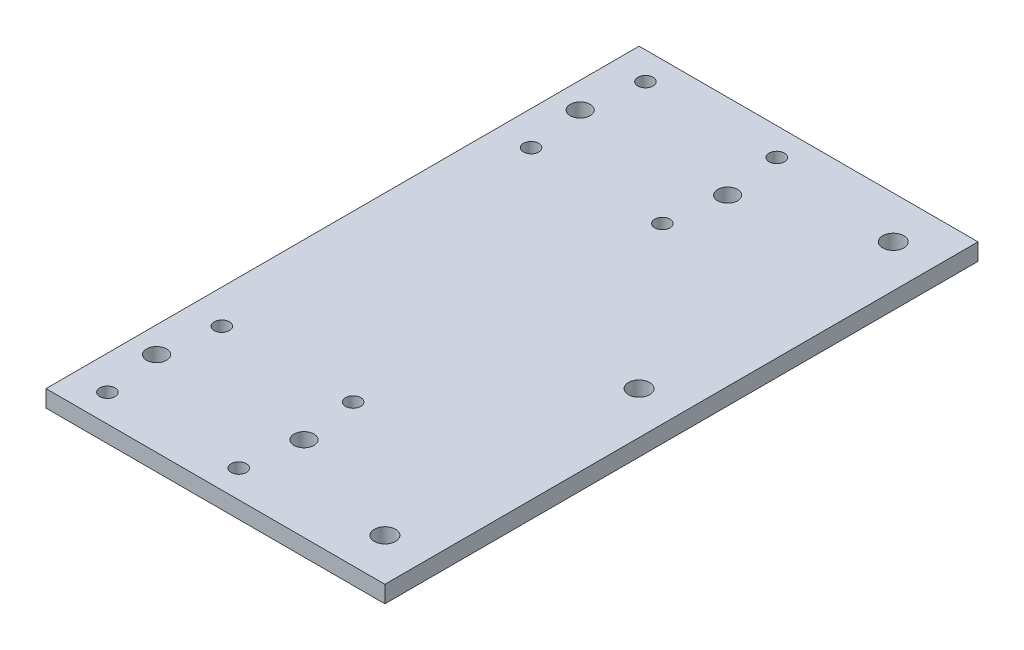
from build123d import *

# Parameters (mm, degrees)
SKETCH_2_W          = 80
SKETCH_2_H          = 140
EXTRUDE_1_DEPTH     = 4
SKETCH_3_R          = 1.8
SKETCH_3_R_2        = 2.35
SKETCH_3_R_3        = 2.5
CUT_EXTRUDE_3_DEPTH = 4


with BuildPart() as part:
    # 草图2 → 凸台-拉伸1 (new body)
    with BuildSketch(Plane(origin=(0, 0, 0), x_dir=(1, 0, 0), z_dir=(0, 1, 0))):
        with Locations((-40, 0)):
            Rectangle(SKETCH_2_W, SKETCH_2_H)
    extrude(amount=EXTRUDE_1_DEPTH)

    # 草图3 → 切除-拉伸3 (cut)
    with BuildSketch(Plane(origin=(0, 4, 0), x_dir=(1, 0, 0), z_dir=(0, 1, 0))):
        with Locations(Location((-72, 63.5, 0), (0, 0, 270))):
            Circle(SKETCH_3_R)
        with Locations(Location((-41, 63.5, 0), (0, 0, 270))):
            Circle(SKETCH_3_R)
        with Locations(Location((-41, 36.5, 0), (0, 0, 270))):
            Circle(SKETCH_3_R)
        with Locations(Location((-72, 36.5, 0), (0, 0, 270))):
            Circle(SKETCH_3_R)
        with Locations(Location((-41, -63.5, 0), (0, 0, 270))):
            Circle(SKETCH_3_R)
        with Locations(Location((-41, -36.5, 0), (0, 0, 270))):
            Circle(SKETCH_3_R)
        with Locations(Location((-72, -36.5, 0), (0, 0, 270))):
            Circle(SKETCH_3_R)
        with Locations(Location((-72, -63.5, 0), (0, 0, 270))):
            Circle(SKETCH_3_R)
        with Locations(Location((-73.9, 50, 0), (0, 0, 270))):
            Circle(SKETCH_3_R_2)
        with Locations(Location((-73.9, -50, 0), (0, 0, 270))):
            Circle(SKETCH_3_R_2)
        with Locations(Location((-39.1, -50, 0), (0, 0, 270))):
            Circle(SKETCH_3_R_2)
        with Locations(Location((-39.1, 50, 0), (0, 0, 270))):
            Circle(SKETCH_3_R_2)
        with Locations(Location((-10, 60, 0), (0, 0, 270))):
            Circle(SKETCH_3_R_3)
        with Locations(Location((-10, 0, 0), (0, 0, 270))):
            Circle(SKETCH_3_R_3)
        with Locations(Location((-10, -60, 0), (0, 0, 270))):
            Circle(SKETCH_3_R_3)
    extrude(amount=-CUT_EXTRUDE_3_DEPTH, mode=Mode.SUBTRACT)


solid = part.part
